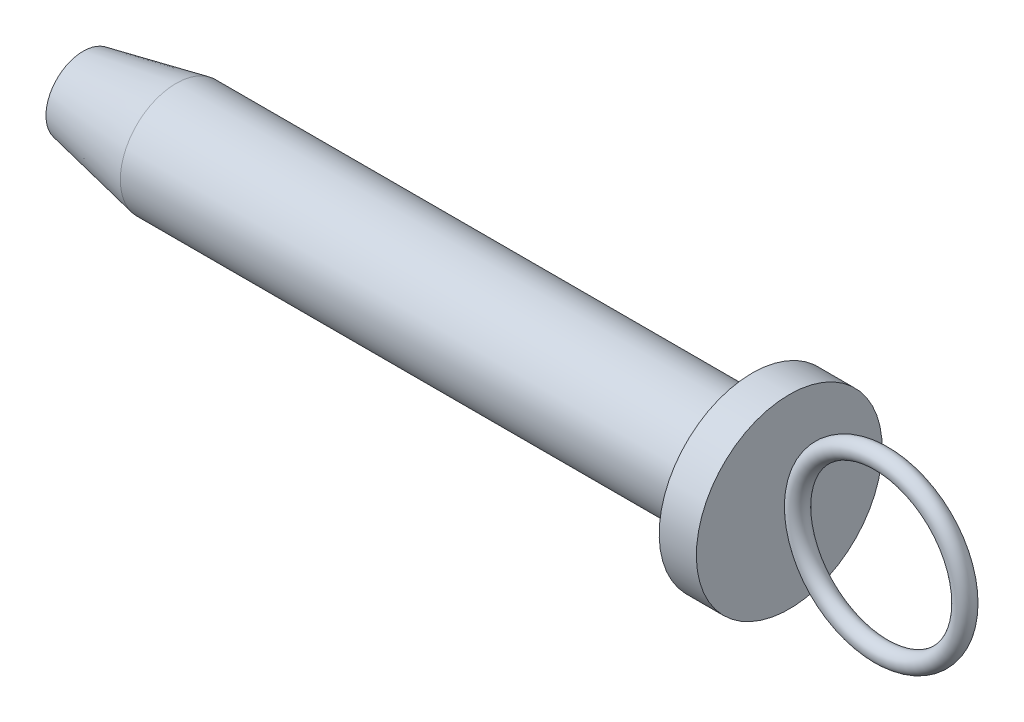
from build123d import *

# Parameters (mm, degrees)
SKETCH_2_R = 5


with BuildPart() as part:
    # 草图1 → 旋转1 (revolve)
    with BuildSketch(Plane.XY):
        Polygon((0, 0), (-380, 0), (-380, 20), (-330, 30), (-20, 30), (-20, 50), (0, 50), align=None)
    revolve(axis=Axis((0, 0, 0), (-1, 0, 0)))

    # 草图2 → 旋转2 (revolve)
    with BuildSketch(Plane(origin=(0, 0, 0), x_dir=(1, 0, 0), z_dir=(0, 1, 0)), mode=Mode.PRIVATE) as revolve_2_sk:
        with Locations((4.5, 0)):
            Circle(SKETCH_2_R)
    revolve(revolve_2_sk.sketch.rotate(Axis((49.5, 0, 1000), (0, 0, -1)), 265.94519807), axis=Axis((49.5, 0, 1000), (0, 0, -1)))


solid = part.part
